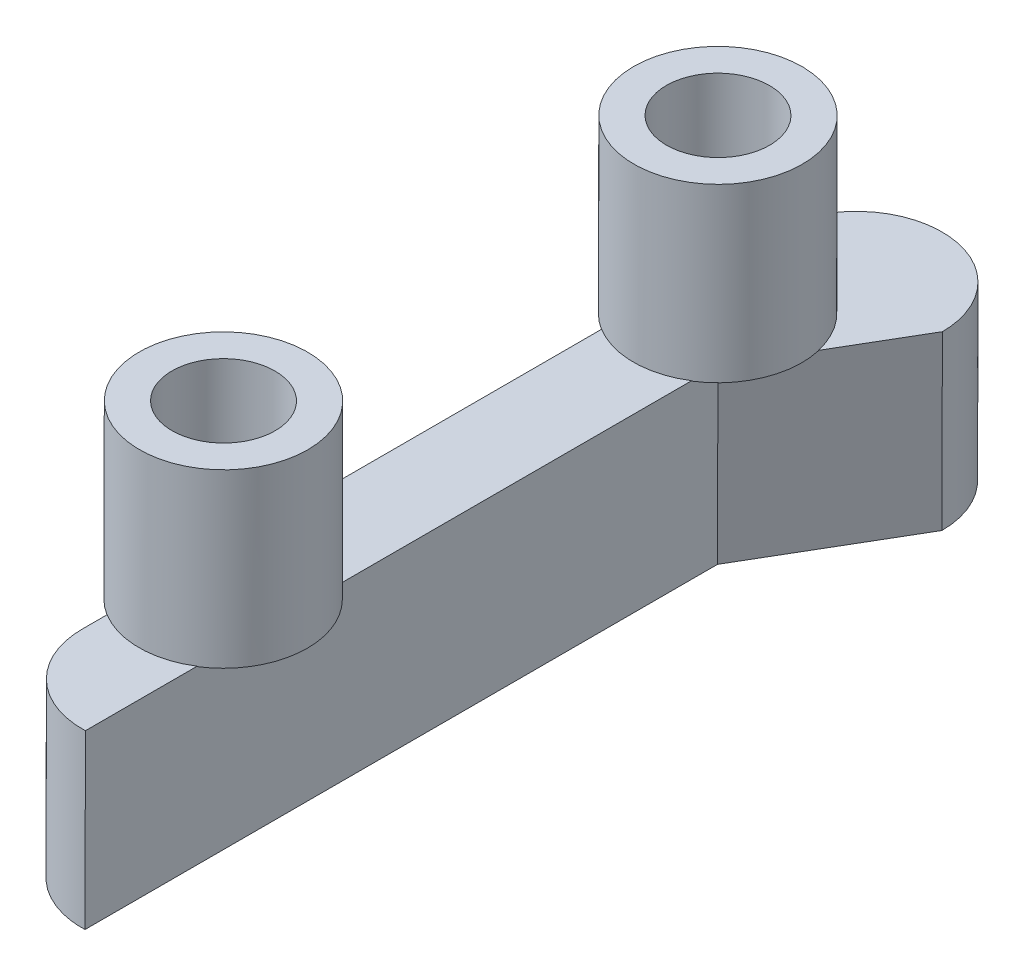
from build123d import *

# Parameters (mm, degrees)
BOSS_EXTRUDE1_DEPTH      = 0.01
BOSS_EXTRUDE1_DEPTH_BACK = 5
SKETCH5_R                = 2.45
SKETCH5_R_2              = 1.5
BOSS_EXTRUDE2_DEPTH      = 5


with BuildPart() as part:
    # Sketch1 → Boss-Extrude1 (new, two sides: drawn at the far end of the back side and taken through both)
    with BuildSketch(Plane(origin=(0.212370974, 88.261171587, 0), x_dir=(0.9999971051966906, -0.0024061583985667905, 0), z_dir=(0.0024061583985667905, 0.9999971051966906, 2.2915916530952404e-15)).offset(-BOSS_EXTRUDE1_DEPTH_BACK)):
        with BuildLine():
            add(Edge.make_bspline(
                [(62.098697441, -271.553297735), (62.098697441, -271.390083561), (62.082868678, -271.227746225), (62.018744893, -270.904868209), (61.970774481, -270.747219765), (61.846181156, -270.44635233), (61.768554488, -270.300830702), (61.586127547, -270.027822449), (61.482834878, -269.902064788), (61.252588694, -269.671493322), (61.124154836, -269.565937636), (60.85291301, -269.384527638), (60.709509325, -269.307646832), (60.406882072, -269.181865969), (60.248191704, -269.13364771), (59.928627436, -269.06981324), (59.765989129, -269.053431748), (59.435435386, -269.053165346), (59.272896926, -269.069262853), (58.953071086, -269.132607362), (58.794102275, -269.180650645), (58.491413646, -269.30591032), (58.347818746, -269.382585434), (58.075961384, -269.563834415), (57.947444391, -269.669183663), (57.601723344, -270.014407111), (57.415265036, -270.29289619), (57.16528984, -270.894119026), (57.098697441, -271.222630203), (57.098697441, -271.553297735)],
                knots=[0, 0, 0, 0, 0.0625, 0.0625, 0.125, 0.125, 0.1875, 0.1875, 0.25, 0.25, 0.3125, 0.3125, 0.375, 0.375, 0.4375, 0.4375, 0.5, 0.5, 0.5625, 0.5625, 0.625, 0.625, 0.6875, 0.6875, 0.75, 0.75, 0.875, 0.875, 1, 1, 1, 1], degree=3))
            Line((57.098697441, -271.553297735), (57.098697441, -288.700730466))
            add(Edge.make_bspline(
                [(57.098697441, -291.553297735), (57.098716176, -291.500037735), (57.098733901, -291.446736965), (57.098944046, -290.775972975), (57.098997483, -290.169015827), (57.098876087, -289.279212217), (57.098803426, -288.988725401), (57.098697441, -288.700730466)],
                knots=[0.466050383, 0.466050383, 0.466050383, 0.466050383, 0.46875, 0.46875, 0.5, 0.5, 0.515336825, 0.515336825, 0.515336825, 0.515336825], degree=3))
            add(Edge.make_bspline(
                [(59.695767456, -294.051424481), (59.664952853, -294.052615647), (59.634064807, -294.053239292), (59.43288412, -294.053593818), (59.260500841, -294.036058258), (58.929915117, -293.968086951), (58.767684875, -293.9170646), (58.460210959, -293.785297782), (58.316149887, -293.70550705), (58.0458038, -293.51937365), (57.92043612, -293.413227178), (57.583512234, -293.067438733), (57.404616617, -292.79348169), (57.223603479, -292.349815403), (57.176716166, -292.193718571), (57.11440851, -291.876470519), (57.098697441, -291.715881831), (57.098697441, -291.553297735)],
                knots=[0.488631618, 0.488631618, 0.488631618, 0.488631618, 0.5, 0.5, 0.5625, 0.5625, 0.625, 0.625, 0.6875, 0.6875, 0.75, 0.75, 0.875, 0.875, 0.9375, 0.9375, 1, 1, 1, 1], degree=3))
            Line((59.695767456, -294.051424481), (59.695767456, -275.672418356))
            Line((59.695767456, -275.672418356), (62.098697441, -271.553297735))
        make_face()
    extrude(amount=BOSS_EXTRUDE1_DEPTH + BOSS_EXTRUDE1_DEPTH_BACK)

    # Sketch5 → Boss-Extrude2 (add)
    # profile 1 of 2: a face of its own
    with BuildSketch(Plane(origin=(0.212370974, 88.261171587, 0), x_dir=(0.9999971051966906, -0.0024061583985667905, 0), z_dir=(0.0024061583985667905, 0.9999971051966906, 2.2915916530952404e-15))):
        with Locations(Location((58.382444571, -274.369066811, 0), (0, 0, 12.765246623))):
            Circle(SKETCH5_R)
        with Locations(Location((58.382444571, -274.369066811, 0), (0, 0, 211.148291833))):
            Circle(SKETCH5_R_2, mode=Mode.SUBTRACT)
    # profile 2 of 2: a face of its own
    with BuildSketch(Plane(origin=(0.212370974, 88.261171587, 0), x_dir=(0.9999971051966906, -0.0024061583985667905, 0), z_dir=(0.0024061583985667905, 0.9999971051966906, 2.2915916530952404e-15))):
        with Locations((58.382444571, -288.73753777)):
            Circle(SKETCH5_R)
        with Locations((58.382444571, -288.73753777)):
            Circle(SKETCH5_R_2, mode=Mode.SUBTRACT)
    extrude(amount=BOSS_EXTRUDE2_DEPTH)


solid = part.part
